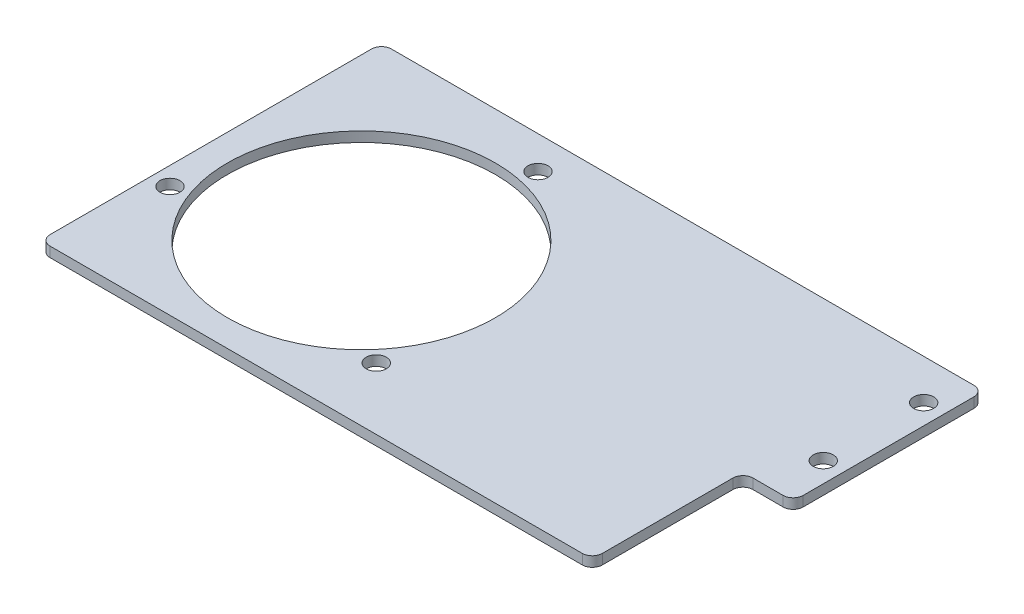
from build123d import *

# Parameters (mm, degrees)
SKETCH1_R           = 84.7725
SKETCH1_R_2         = 6.35
BOSS_EXTRUDE1_DEPTH = 6.35


with BuildPart() as part:
    # Sketch1 → Boss-Extrude1 (new body)
    with BuildSketch(Plane(origin=(0, 0, 0), x_dir=(1, 0, 0), z_dir=(0, 1, 0))):
        with BuildLine():
            Line((273.05, 114.3), (-95.25, 114.3))
            ThreePointArc((-95.25, 114.3), (-99.740128061, 112.440128061), (-101.6, 107.95))
            Line((-101.6, 107.95), (-101.6, -95.25))
            ThreePointArc((-101.6, -95.25), (-99.740128061, -99.740128061), (-95.25, -101.6))
            Line((-95.25, -101.6), (241.3, -101.6))
            ThreePointArc((241.3, -101.6), (245.790128061, -99.740128061), (247.65, -95.25))
            Line((247.65, -95.25), (247.65, -12.7))
            ThreePointArc((247.65, -12.7), (249.509871939, -8.209871939), (254, -6.35))
            Line((254, -6.35), (273.05, -6.35))
            ThreePointArc((273.05, -6.35), (277.540128061, -4.490128061), (279.4, 0))
            Line((279.4, 0), (279.4, 107.95))
            ThreePointArc((279.4, 107.95), (277.540128061, 112.440128061), (273.05, 114.3))
        make_face()
        with Locations(Location((0, 0, 0), (0, 0, 270))):
            Circle(SKETCH1_R, mode=Mode.SUBTRACT)
        with Locations(Location((-90.060644326, -31.010366712, 0), (0, 0, 270))):
            Circle(SKETCH1_R_2, mode=Mode.SUBTRACT)
        with Locations(Location((18.17455681, 93.499989223, 0), (0, 0, 270))):
            Circle(SKETCH1_R_2, mode=Mode.SUBTRACT)
        with Locations(Location((71.886087516, -62.489622511, 0), (0, 0, 270))):
            Circle(SKETCH1_R_2, mode=Mode.SUBTRACT)
        with Locations(Location((266.7, 88.9, 0), (0, 0, 270))):
            Circle(SKETCH1_R_2, mode=Mode.SUBTRACT)
        with Locations(Location((266.7, 25.4, 0), (0, 0, 270))):
            Circle(SKETCH1_R_2, mode=Mode.SUBTRACT)
    extrude(amount=BOSS_EXTRUDE1_DEPTH)


solid = part.part
